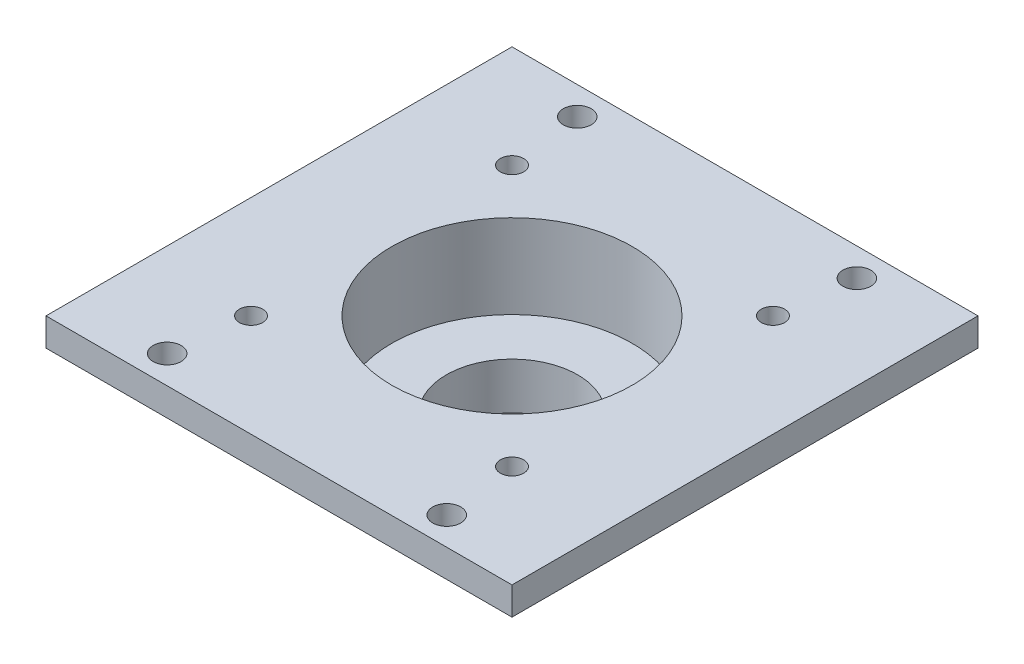
from build123d import *

# Parameters (mm, degrees)
BOSS_EXTRUDE1_START = -3
SKETCH3_W           = 50
SKETCH3_H           = 50
SKETCH3_R           = 14.9
BOSS_EXTRUDE1_DEPTH = 3
SKETCH4_R           = 1.25
SKETCH4_R_2         = 1.5
CUT_EXTRUDE1_DEPTH  = 39.026306684
FILLET1_R           = 2


with BuildPart() as part:
    # Sketch2 → Revolve-Thin1 (revolve)
    with BuildSketch(Plane.XY, mode=Mode.PRIVATE) as revolve_thin1_sk:
        Polygon((7.05, 0), (7.05, 5), (12.9, 5), (12.9, 14), (14.9, 14), (14.9, 3), (9.05, 3), (9.05, 0), align=None)
    revolve(revolve_thin1_sk.sketch.rotate(Axis((0, 56.528570812, 0), (0, -1, 0)), 90), axis=Axis((0, 56.528570812, 0), (0, -1, 0)))

    # Sketch3 → Boss-Extrude1 (add)
    with BuildSketch(Plane(origin=(0, 14, 0), x_dir=(1, 0, 0), z_dir=(0, 1, 0)).offset(BOSS_EXTRUDE1_START)):
        Rectangle(SKETCH3_W, SKETCH3_H)
        with Locations(Location((0, 0, 0), (0, 0, 270))):
            Circle(SKETCH3_R, mode=Mode.SUBTRACT)
    extrude(amount=BOSS_EXTRUDE1_DEPTH)

    # Sketch4 → Cut-Extrude1 (cut, through all)
    with BuildSketch(Plane(origin=(0, 14, 0), x_dir=(1, 0, 0), z_dir=(0, 1, 0))):
        with Locations(Location((14, 14, 0), (0, 0, 270))):
            Circle(SKETCH4_R)
        with Locations(Location((-14, 14, 0), (0, 0, 270))):
            Circle(SKETCH4_R)
        with Locations(Location((-14, -14, 0), (0, 0, 270))):
            Circle(SKETCH4_R)
        with Locations(Location((14, -14, 0), (0, 0, 270))):
            Circle(SKETCH4_R)
        with Locations(Location((-15, 22, 0), (0, 0, 270))):
            Circle(SKETCH4_R_2)
        with Locations(Location((15, 22, 0), (0, 0, 270))):
            Circle(SKETCH4_R_2)
        with Locations(Location((15, -22, 0), (0, 0, 270))):
            Circle(SKETCH4_R_2)
        with Locations(Location((-15, -22, 0), (0, 0, 270))):
            Circle(SKETCH4_R_2)
    extrude(amount=-CUT_EXTRUDE1_DEPTH, mode=Mode.SUBTRACT)

    # Fillet1
    fillet1_edges = [part.edges().sort_by_distance(p)[0] for p in [
        (0, 11, -14.9),
    ]]
    fillet(fillet1_edges, radius=FILLET1_R)


solid = part.part
